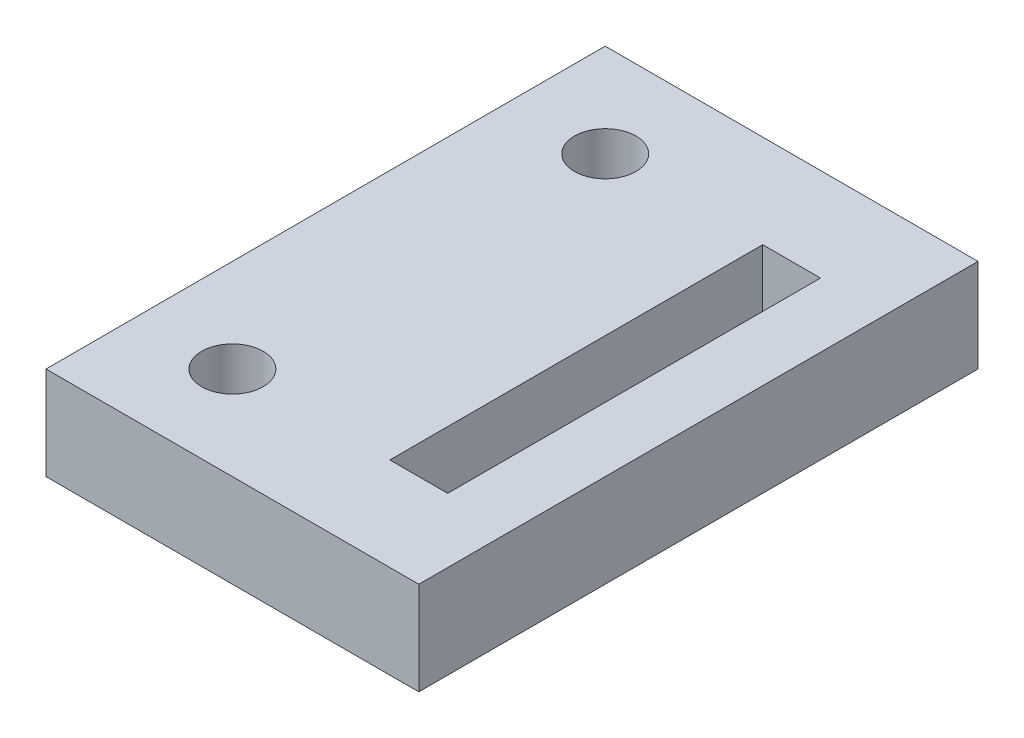
from build123d import *

# Parameters (mm, degrees)
SKETCH1_W           = 10
SKETCH1_H           = 15
SKETCH1_R           = 1.65
BOSS_EXTRUDE1_DEPTH = 5


with BuildPart() as part:
    # Sketch1 → Boss-Extrude1 (new body)
    # profile 1 of 4: a face of its own
    with BuildSketch(Plane(origin=(0, 0, 0), x_dir=(1, 0, 0), z_dir=(0, 1, 0))):
        with Locations((5, 22.5)):
            Rectangle(SKETCH1_W, SKETCH1_H)
        with Locations(Location((5, 25, 0), (0, 0, 270))):
            Circle(SKETCH1_R, mode=Mode.SUBTRACT)
    # profile 2 of 4: a face of its own
    with BuildSketch(Plane(origin=(0, 0, 0), x_dir=(1, 0, 0), z_dir=(0, 1, 0))):
        Polygon((10, 30), (10, 15), (13.45, 15), (13.45, 25), (16.55, 25), (16.55, 15), (20, 15), (20, 30), align=None)
    # profile 3 of 4: a face of its own
    with BuildSketch(Plane(origin=(0, 0, 0), x_dir=(1, 0, 0), z_dir=(0, 1, 0))):
        Polygon((13.45, 15), (10, 15), (10, 0), (20, 0), (20, 15), (16.55, 15), (16.55, 5), (13.45, 5), align=None)
    # profile 4 of 4: a face of its own
    with BuildSketch(Plane(origin=(0, 0, 0), x_dir=(1, 0, 0), z_dir=(0, 1, 0))):
        with Locations((5, 7.5)):
            Rectangle(SKETCH1_W, SKETCH1_H)
        with Locations(Location((5, 5, 0), (0, 0, 270))):
            Circle(SKETCH1_R, mode=Mode.SUBTRACT)
    extrude(amount=BOSS_EXTRUDE1_DEPTH)


solid = part.part
